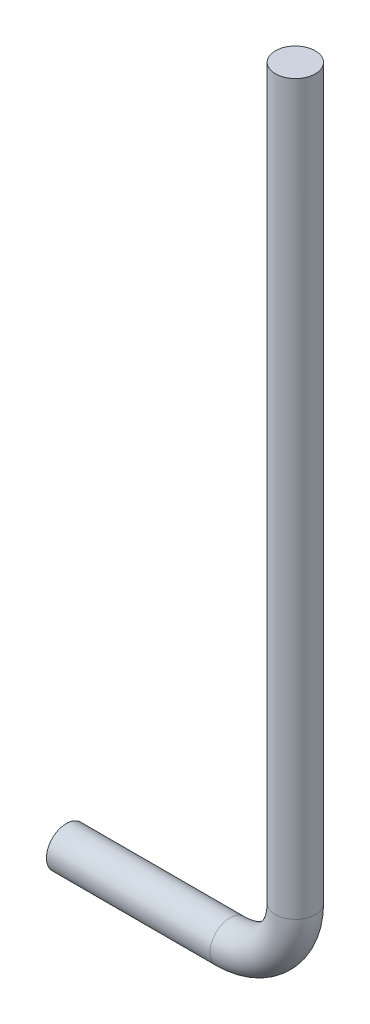
from build123d import *

# Parameters (mm, degrees)
SKETCH2_R           = 3.05
SKETCH3_R           = 3.05
BOSS_EXTRUDE1_DEPTH = 10


with BuildPart() as part:
    # Sweep2: sweep along a path in Sketch1
    with BuildLine(Plane.XY.offset(-5)) as sweep2_path:
        Line((35, 88.3), (35, -13))
        ThreePointArc((35, -13), (32.071067812, -20.071067812), (25, -23))
        Line((25, -23), (0, -23))
    # Sketch2 → Sweep2 (sweep)
    with BuildSketch(Plane(origin=(0, 88.3, 0), x_dir=(1, 0, 0), z_dir=(0, 1, 0))):
        with Locations((35, 5)):
            Circle(SKETCH2_R)
    sweep(path=sweep2_path.line)

    # Sketch3 → Boss-Extrude1 (add)
    with BuildSketch(Plane(origin=(0, 88.3, 0), x_dir=(1, 0, 0), z_dir=(0, 1, 0))):
        with Locations(Location((35, 5, 0), (0, 0, 270))):
            Circle(SKETCH3_R)
    extrude(amount=BOSS_EXTRUDE1_DEPTH)


solid = part.part
